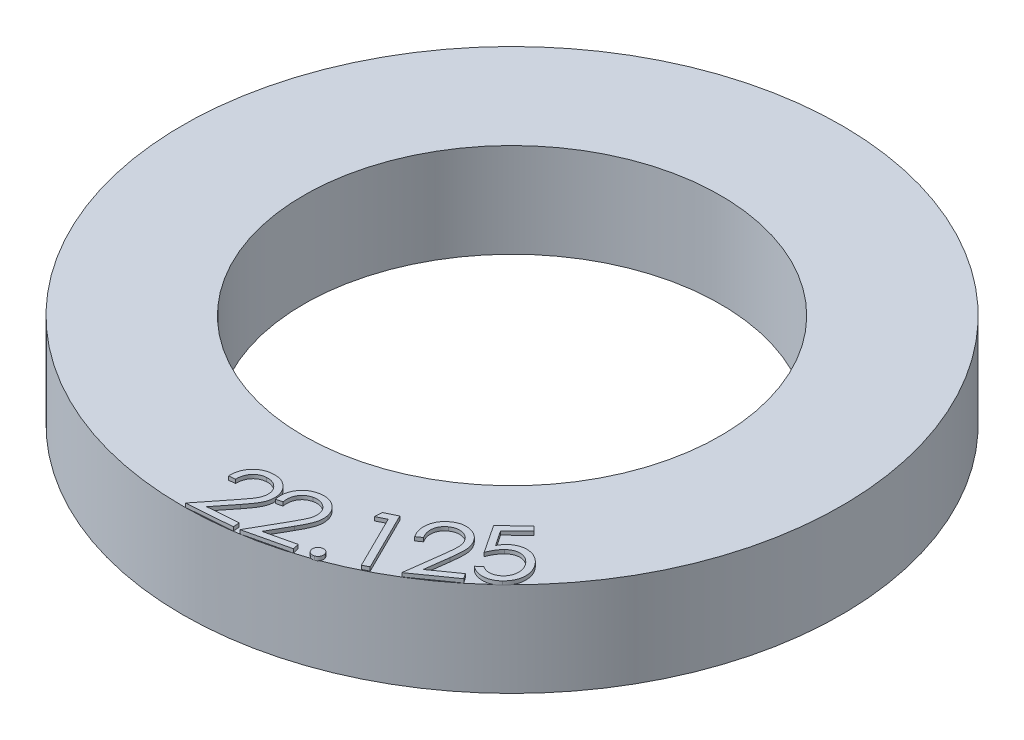
from build123d import *

# Parameters (mm, degrees)
SKETCH1_R           = 17.5
SKETCH1_R_2         = 11.0625
BOSS_EXTRUDE1_DEPTH = 5
BOSS_EXTRUDE6_DEPTH = 0.2


with BuildPart() as part:
    # Sketch1 → Boss-Extrude1 (new body)
    with BuildSketch(Plane(origin=(0, 0, 0), x_dir=(1, 0, 0), z_dir=(0, 1, 0))):
        Circle(SKETCH1_R)
        Circle(SKETCH1_R_2, mode=Mode.SUBTRACT)
    extrude(amount=BOSS_EXTRUDE1_DEPTH)

    # Sketch6 → Boss-Extrude6 (add)
    with BuildSketch(Plane(origin=(0, 5, 0), x_dir=(1, 0, 0), z_dir=(0, 1, 0))):
        with BuildLine():
            Line((0.377203526, -15.06640625), (0.043469551, -15.092347756))
            add(Edge.make_bspline(
                [(0.043469551, -15.092347756), (0.042203297, -15.050032699), (0.039723419, -14.96716131), (0.049638285, -14.844981972), (0.067688405, -14.727624407), (0.098455755, -14.61556583), (0.138504263, -14.508522308), (0.188279293, -14.405930448), (0.249943807, -14.309195828), (0.320224245, -14.217586795), (0.399116148, -14.133937543), (0.484222111, -14.059456033), (0.574336923, -13.993992114), (0.671078969, -13.940092371), (0.773224869, -13.895612995), (0.881084602, -13.861423192), (0.994390789, -13.836174987), (1.072362547, -13.828578994), (1.111979167, -13.824719551)],
                knots=[0, 0, 0, 0, 1.099165856, 2.152647473, 3.179901334, 4.180092559, 5.165857059, 6.14623908, 7.136854445, 8.141313093, 9.142222958, 10.119044223, 11.076246807, 12.030555843, 12.990566437, 13.966122304, 14.966608418, 16, 16, 16, 16], degree=3))
            add(Edge.make_bspline(
                [(1.111979167, -13.824719551), (1.151232363, -13.822614291), (1.227892409, -13.818502795), (1.341072803, -13.824300473), (1.449209712, -13.840047194), (1.552456645, -13.867170925), (1.650809554, -13.903432336), (1.744251767, -13.950064736), (1.832189716, -14.007297288), (1.914237577, -14.07371881), (1.989801801, -14.146775331), (2.056191283, -14.225750107), (2.115236363, -14.307662186), (2.163673815, -14.394967734), (2.203994369, -14.485852699), (2.23381166, -14.581483532), (2.256306856, -14.680631266), (2.263224051, -14.74868976), (2.266726763, -14.783153045)],
                knots=[0, 0, 0, 0, 1.125255338, 2.197582177, 3.23984224, 4.249678898, 5.249348258, 6.237204937, 7.234226399, 8.248247252, 9.256507582, 10.239567543, 11.199778339, 12.143800945, 13.093950023, 14.042329097, 15.008679649, 16, 16, 16, 16], degree=3))
            add(Edge.make_bspline(
                [(2.266726763, -14.783153045), (2.268653871, -14.83201524), (2.272472697, -14.928842275), (2.256591946, -15.073272294), (2.221554197, -15.213909987), (2.177756368, -15.329043673), (2.13210079, -15.422970742), (2.088829613, -15.499650514), (2.039151976, -15.583479859), (1.980752569, -15.67318269), (1.913642882, -15.76882397), (1.840613729, -15.872212721), (1.757921696, -15.980725817), (1.700055339, -16.055042687), (1.670072115, -16.093549679)],
                knots=[0, 0, 0, 0, 1.190284496, 2.358709392, 3.525773572, 4.713480732, 5.352743619, 6.06901355, 6.858115264, 7.726847504, 8.676217017, 9.704931629, 10.810819393, 12, 12, 12, 12], degree=3))
            Line((1.670072115, -16.093549679), (0.875701122, -17.094751603))
            Line((0.875701122, -17.094751603), (2.482672276, -16.971354167))
            Line((2.482672276, -16.971354167), (2.508613782, -17.307191506))
            Line((2.508613782, -17.307191506), (0.14443109, -17.488782051))
            Line((0.14443109, -17.488782051), (1.363681891, -15.949819712))
            add(Edge.make_bspline(
                [(1.363681891, -15.949819712), (1.393527022, -15.912554926), (1.450782044, -15.841066007), (1.530584566, -15.73612355), (1.602999147, -15.639675593), (1.666852925, -15.550639363), (1.722438282, -15.469396851), (1.76961629, -15.395481899), (1.809021619, -15.329602995), (1.849329165, -15.251857602), (1.888211722, -15.159145837), (1.917541309, -15.046099013), (1.933704742, -14.93175562), (1.93042781, -14.855174346), (1.928786058, -14.816806891)],
                knots=[0, 0, 0, 0, 1.323859622, 2.539697786, 3.655679983, 4.668207506, 5.577749991, 6.384956845, 7.099630202, 7.705429782, 8.812646299, 9.878423536, 10.93708365, 12, 12, 12, 12], degree=3))
            add(Edge.make_bspline(
                [(1.928786058, -14.816806891), (1.92620974, -14.792668697), (1.921140936, -14.745177743), (1.905685163, -14.675960851), (1.882668381, -14.610204079), (1.854314913, -14.54686504), (1.818130268, -14.487171166), (1.775716227, -14.430480301), (1.726271651, -14.377301953), (1.671340099, -14.327125852), (1.611934069, -14.281949704), (1.548780398, -14.24375581), (1.483443961, -14.212316408), (1.415907726, -14.186368957), (1.345139571, -14.169292508), (1.271999298, -14.157876025), (1.196114655, -14.153502913), (1.144924611, -14.156323447), (1.118990385, -14.157752404)],
                knots=[0, 0, 0, 0, 1.002985613, 1.973335034, 2.923515741, 3.878986154, 4.836651989, 5.802759845, 6.800988188, 7.833639541, 8.87511098, 9.880838076, 10.878972912, 11.86950441, 12.865345595, 13.881918786, 14.926924211, 16, 16, 16, 16], degree=3))
            add(Edge.make_bspline(
                [(1.118990385, -14.157752404), (1.091811261, -14.160540619), (1.038491161, -14.166010548), (0.960749235, -14.182373159), (0.886899306, -14.205342141), (0.817246391, -14.235736869), (0.751710741, -14.272344942), (0.690146343, -14.315288584), (0.633132276, -14.365692478), (0.580060436, -14.422065975), (0.532383632, -14.484564259), (0.490634628, -14.552362028), (0.455698611, -14.625546395), (0.426899376, -14.703718722), (0.404472482, -14.787020099), (0.388336351, -14.875402791), (0.379467781, -14.969236984), (0.377971809, -15.033435801), (0.377203526, -15.06640625)],
                knots=[0, 0, 0, 0, 1.003856858, 1.969369873, 2.914991585, 3.842326504, 4.757764574, 5.67065914, 6.596081697, 7.550367434, 8.512664105, 9.480773, 10.472199548, 11.488843046, 12.539268398, 13.639696742, 14.787824085, 16, 16, 16, 16], degree=3))
        make_face()
        with BuildLine():
            Line((2.680077799, -14.84254585), (2.355458408, -14.918267004))
            add(Edge.make_bspline(
                [(2.355458408, -14.918267004), (2.347994142, -14.876767046), (2.333387531, -14.795556953), (2.323472579, -14.673990721), (2.324976016, -14.555728299), (2.336513827, -14.440605451), (2.359783356, -14.328975701), (2.394590343, -14.221092867), (2.439601661, -14.116379831), (2.494569659, -14.015576781), (2.559832485, -13.921863348), (2.631188548, -13.834656401), (2.710921768, -13.757361702), (2.797573287, -13.688946733), (2.891342116, -13.629703088), (2.992353062, -13.580084855), (3.099856127, -13.537971321), (3.175300136, -13.518303724), (3.213631485, -13.508311075)],
                knots=[0, 0, 0, 0, 1.100238416, 2.153025381, 3.178012026, 4.183884262, 5.168591255, 6.148695239, 7.138002634, 8.140019377, 9.140121407, 10.114951831, 11.077023251, 12.032670763, 12.99234068, 13.966349905, 14.966749606, 16, 16, 16, 16], degree=3))
            add(Edge.make_bspline(
                [(3.213631485, -13.508311075), (3.251843088, -13.50036415), (3.32664053, -13.484808413), (3.438897548, -13.473770246), (3.547813259, -13.472847982), (3.653615731, -13.482442125), (3.755983303, -13.503477882), (3.854414489, -13.536291351), (3.950096274, -13.578421826), (4.040814221, -13.631584861), (4.126003653, -13.692404589), (4.204208412, -13.758970295), (4.274030899, -13.831494589), (4.335160407, -13.90960072), (4.388361962, -13.993145467), (4.432982751, -14.082231672), (4.470178835, -14.176708828), (4.487307474, -14.242643219), (4.495983248, -14.27603944)],
                knots=[0, 0, 0, 0, 1.121990491, 2.196244399, 3.238232453, 4.250969426, 5.246356061, 6.236987075, 7.230101134, 8.248200839, 9.255501669, 10.237657177, 11.19803806, 12.146105858, 13.086011545, 14.042029985, 15.008274769, 16, 16, 16, 16], degree=3))
            add(Edge.make_bspline(
                [(4.495983248, -14.27603944), (4.505415824, -14.323774993), (4.524110077, -14.41838123), (4.529985585, -14.56283772), (4.516844757, -14.706380405), (4.49162199, -14.826395359), (4.460506924, -14.925374116), (4.431085731, -15.007919873), (4.393488718, -15.097141834), (4.349829317, -15.194418504), (4.299347185, -15.299042154), (4.242538162, -15.411720311), (4.177915647, -15.531101044), (4.131979942, -15.612908193), (4.108262895, -15.655146011)],
                knots=[0, 0, 0, 0, 1.190223456, 2.358882579, 3.52524119, 4.712819824, 5.35365978, 6.065105631, 6.857984567, 7.723828008, 8.67607557, 9.702436758, 10.813745988, 12, 12, 12, 12], degree=3))
            Line((4.108262895, -15.655146011), (3.479356645, -16.761516203))
            Line((3.479356645, -16.761516203), (5.041456004, -16.394829504))
            Line((5.041456004, -16.394829504), (5.11787828, -16.721552261))
            Line((5.11787828, -16.721552261), (2.819601036, -17.260714921))
            Line((2.819601036, -17.260714921), (3.785045748, -15.56119569))
            add(Edge.make_bspline(
                [(3.785045748, -15.56119569), (3.808529371, -15.519892567), (3.8536226, -15.440582352), (3.91665988, -15.325551236), (3.973290102, -15.219474376), (4.021957514, -15.121779814), (4.064311127, -15.032979861), (4.100364837, -14.953571722), (4.128654637, -14.882434307), (4.156784414, -14.800101176), (4.179688984, -14.702577351), (4.192972915, -14.587024863), (4.189968714, -14.471889792), (4.175230987, -14.396958355), (4.167858248, -14.359472934)],
                knots=[0, 0, 0, 0, 1.322508168, 2.539478858, 3.65113322, 4.669382137, 5.577246142, 6.389686428, 7.096378664, 7.707362647, 8.810322298, 9.877140803, 10.938012216, 12, 12, 12, 12], degree=3))
            add(Edge.make_bspline(
                [(4.167858248, -14.359472934), (4.161829404, -14.336171476), (4.149935411, -14.290201239), (4.123387221, -14.224893717), (4.091995869, -14.16328915), (4.053584185, -14.106135055), (4.009399893, -14.052600205), (3.95860095, -14.003544562), (3.901957352, -13.958350343), (3.840235373, -13.917568468), (3.775029978, -13.881814057), (3.707248163, -13.853637752), (3.637912338, -13.832678602), (3.56741324, -13.817301491), (3.494890393, -13.811664684), (3.421495235, -13.811468351), (3.346244991, -13.818247864), (3.296509601, -13.82889709), (3.271123472, -13.834332709)],
                knots=[0, 0, 0, 0, 0.998805992, 1.97049261, 2.921394182, 3.866479787, 4.824835265, 5.799717433, 6.794315519, 7.830951375, 8.869177059, 9.878822869, 10.873799922, 11.875291578, 12.869368348, 13.888722291, 14.922353531, 16, 16, 16, 16], degree=3))
            add(Edge.make_bspline(
                [(3.271123472, -13.834332709), (3.244792519, -13.841064204), (3.193002937, -13.854304184), (3.119061623, -13.882705923), (3.050115946, -13.91714881), (2.986034959, -13.957311139), (2.926579811, -14.002814596), (2.87305675, -14.05555418), (2.823928987, -14.113545846), (2.780414933, -14.177443519), (2.743380272, -14.246402199), (2.712244756, -14.319205359), (2.689061885, -14.396615139), (2.673136557, -14.477873433), (2.664009273, -14.563501926), (2.662180891, -14.653056839), (2.666949138, -14.746824786), (2.675629023, -14.810109822), (2.680077799, -14.84254585)],
                knots=[0, 0, 0, 0, 1.001857296, 1.97052376, 2.915105733, 3.840812044, 4.756468097, 5.670946457, 6.606992161, 7.556283339, 8.516782409, 9.490308786, 10.47212129, 11.491627338, 12.540773751, 13.644567144, 14.792749573, 16, 16, 16, 16], degree=3))
        make_face()
        with BuildLine():
            add(Edge.make_bspline(
                [(5.812610444, -15.938128556), (5.831374417, -15.932374898), (5.868100028, -15.921113607), (5.925587729, -15.918820778), (5.982023209, -15.927326543), (6.036365652, -15.947186897), (6.086750753, -15.976062519), (6.129683552, -16.014781695), (6.164195697, -16.061839206), (6.179302393, -16.097844445), (6.187009483, -16.116213491)],
                knots=[0, 0, 0, 0, 1.018533362, 1.993514881, 2.966138152, 3.9748784, 4.989476654, 5.972026843, 6.965374611, 8, 8, 8, 8], degree=3))
            add(Edge.make_bspline(
                [(6.187009483, -16.116213491), (6.192680674, -16.134982532), (6.203852009, -16.171954526), (6.207259114, -16.229869607), (6.198423544, -16.286997519), (6.178873974, -16.341926891), (6.149719297, -16.392227049), (6.111823907, -16.435344643), (6.065578658, -16.469979456), (6.029886494, -16.484584723), (6.011729034, -16.492014773)],
                knots=[0, 0, 0, 0, 1.018247088, 2.005783202, 2.990165439, 4.010083513, 5.024396598, 5.998572224, 6.981825626, 8, 8, 8, 8], degree=3))
            add(Edge.make_bspline(
                [(6.011729034, -16.492014773), (5.992964701, -16.497770106), (5.956238387, -16.509034678), (5.898755786, -16.511303732), (5.842003107, -16.502843983), (5.787364663, -16.482393394), (5.737095106, -16.452595757), (5.694096527, -16.414271405), (5.660232144, -16.367416245), (5.645083379, -16.332037335), (5.637329996, -16.313929838)],
                knots=[0, 0, 0, 0, 1.019327242, 1.995068695, 2.968450063, 3.99358383, 5.015165017, 5.99848104, 6.975590248, 8, 8, 8, 8], degree=3))
            add(Edge.make_bspline(
                [(5.637329996, -16.313929838), (5.63125142, -16.294941947), (5.619366426, -16.257816312), (5.617673921, -16.1996281), (5.624612676, -16.142442807), (5.645777227, -16.087974496), (5.675371175, -16.038150206), (5.712952105, -15.994657098), (5.759716127, -15.961248414), (5.794765915, -15.945928316), (5.812610444, -15.938128556)],
                knots=[0, 0, 0, 0, 1.033330105, 2.02039479, 3.003248301, 4.016090021, 5.036799157, 6.01117572, 6.98745084, 8, 8, 8, 8], degree=3))
        make_face()
        Polygon((5.818273577, -12.696277718), (6.43245627, -12.391289737), (7.984038802, -15.51759182), (7.673441847, -15.671838615), (6.274002744, -12.851926756), (5.783217488, -13.095216019), align=None)
        with BuildLine():
            Line((8.050451954, -12.754316345), (7.778416698, -12.946423717))
            add(Edge.make_bspline(
                [(7.778416698, -12.946423717), (7.75574982, -12.911071608), (7.711236137, -12.841646407), (7.657400837, -12.73213566), (7.614471669, -12.622110368), (7.582436796, -12.511152703), (7.561988666, -12.399113636), (7.552932152, -12.285912712), (7.554820027, -12.171722581), (7.569204713, -12.057910275), (7.593409527, -11.946382394), (7.62776704, -11.839210811), (7.672436867, -11.737666062), (7.725890768, -11.641112131), (7.79168322, -11.551877682), (7.865376088, -11.467017122), (7.949826615, -11.388142819), (8.012361399, -11.341448202), (8.044141858, -11.317717787)],
                knots=[0, 0, 0, 0, 1.095910755, 2.15217216, 3.180126126, 4.176880321, 5.163267028, 6.149049379, 7.137906323, 8.140157143, 9.13972864, 10.114396539, 11.073656743, 12.032781037, 12.989864371, 13.963002478, 14.964788651, 16, 16, 16, 16], degree=3))
            add(Edge.make_bspline(
                [(8.044141858, -11.317717787), (8.076472772, -11.295823523), (8.139898005, -11.252872407), (8.239602263, -11.200435781), (8.340159306, -11.159320127), (8.441509898, -11.128739377), (8.544029438, -11.109825824), (8.647456298, -11.101966441), (8.751596202, -11.105561252), (8.855601523, -11.120422057), (8.956988223, -11.145096031), (9.054630438, -11.176757121), (9.145718513, -11.219123476), (9.232893852, -11.266708516), (9.312822977, -11.325339494), (9.388367885, -11.390285486), (9.457612974, -11.464633547), (9.498524369, -11.519247649), (9.519302115, -11.546984614)],
                knots=[0, 0, 0, 0, 1.123413124, 2.203857893, 3.235853446, 4.246956373, 5.245898599, 6.230969123, 7.227279684, 8.239657717, 9.24977525, 10.228460745, 11.188962283, 12.137823534, 13.082621121, 14.036430835, 15.002758488, 16, 16, 16, 16], degree=3))
            add(Edge.make_bspline(
                [(9.519302115, -11.546984614), (9.546136241, -11.587705558), (9.599185969, -11.668208831), (9.658881509, -11.800157687), (9.702061595, -11.937869617), (9.722679402, -12.058885035), (9.732181386, -12.162185813), (9.734148543, -12.249728189), (9.734685561, -12.346541682), (9.729584649, -12.452882377), (9.723214718, -12.568900579), (9.71118776, -12.694325344), (9.697732364, -12.829303694), (9.685497933, -12.922148442), (9.679157884, -12.970261858)],
                knots=[0, 0, 0, 0, 1.192690377, 2.357889283, 3.532704618, 4.718274557, 5.356120917, 6.071885258, 6.861684818, 7.72656775, 8.678338785, 9.706873352, 10.81167048, 12, 12, 12, 12], degree=3))
            Line((9.679157884, -12.970261858), (9.512290897, -14.230878845))
            Line((9.512290897, -14.230878845), (10.821285288, -13.304696954))
            Line((10.821285288, -13.304696954), (11.015496025, -13.578835576))
            Line((11.015496025, -13.578835576), (9.089514454, -14.941816345))
            Line((9.089514454, -14.941816345), (9.344722788, -13.005317947))
            add(Edge.make_bspline(
                [(9.344722788, -13.005317947), (9.350876253, -12.958119344), (9.362688595, -12.86751576), (9.378466315, -12.736925142), (9.390139674, -12.617201917), (9.399637953, -12.508325237), (9.40541387, -12.410129646), (9.407505869, -12.322670012), (9.407018709, -12.24619548), (9.40284618, -12.159549845), (9.387983767, -12.060735698), (9.35662303, -11.949019827), (9.309914016, -11.84385806), (9.268689788, -11.779736732), (9.24796798, -11.747505447)],
                knots=[0, 0, 0, 0, 1.324853112, 2.543220171, 3.661061288, 4.672878806, 5.585066668, 6.398427791, 7.107504353, 7.713344522, 8.811787278, 9.880452689, 10.934586436, 12, 12, 12, 12], degree=3))
            add(Edge.make_bspline(
                [(9.24796798, -11.747505447), (9.233657583, -11.728231526), (9.205439981, -11.690226719), (9.156305176, -11.639664518), (9.103798852, -11.594377304), (9.046418065, -11.555725547), (8.985430881, -11.522711926), (8.920190146, -11.495616733), (8.850675878, -11.475851572), (8.778309459, -11.460808051), (8.704311792, -11.453588897), (8.630865103, -11.451618421), (8.558426348, -11.458031186), (8.487892712, -11.472366479), (8.41818143, -11.492610084), (8.350278879, -11.521041939), (8.283220962, -11.555981846), (8.240903361, -11.584427953), (8.219422307, -11.598867627)],
                knots=[0, 0, 0, 0, 0.995891806, 1.963724675, 2.920595791, 3.870799422, 4.83047179, 5.796502588, 6.797676676, 7.827373342, 8.86163348, 9.880849032, 10.874610586, 11.873854222, 12.865718377, 13.884009387, 14.92589116, 16, 16, 16, 16], degree=3))
            add(Edge.make_bspline(
                [(8.219422307, -11.598867627), (8.197589765, -11.615054748), (8.154752739, -11.646815049), (8.096961715, -11.700815823), (8.045494088, -11.757941208), (8.001952156, -11.819711245), (7.964339584, -11.884261253), (7.934384174, -11.952862894), (7.909880694, -12.024678442), (7.89445669, -12.10031943), (7.884819795, -12.177945688), (7.884534713, -12.257144815), (7.89140539, -12.337478617), (7.907111722, -12.419166672), (7.931153756, -12.501882181), (7.963168631, -12.585625545), (8.002095467, -12.670812788), (8.034085463, -12.726054154), (8.050451954, -12.754316345)],
                knots=[0, 0, 0, 0, 1.002821556, 1.9676084, 2.914987817, 3.836871811, 4.753084116, 5.668686655, 6.59648861, 7.549354221, 8.513755073, 9.480276974, 10.467796518, 11.486640661, 12.546326272, 13.644184179, 14.79473446, 16, 16, 16, 16], degree=3))
        make_face()
        with BuildLine():
            Line((10.452754524, -9.291042604), (10.68552696, -9.530826258))
            Line((10.68552696, -9.530826258), (9.789493306, -10.399516162))
            Line((9.789493306, -10.399516162), (10.327954844, -11.205105104))
            add(Edge.make_bspline(
                [(10.327954844, -11.205105104), (10.347405355, -11.172122652), (10.385204959, -11.108025431), (10.446885728, -11.0193262), (10.509702256, -10.939697419), (10.555405561, -10.893202352), (10.577554203, -10.870670008)],
                knots=[0, 0, 0, 0, 1.0972362, 2.132339663, 3.094898282, 4, 4, 4, 4], degree=3))
            add(Edge.make_bspline(
                [(10.577554203, -10.870670008), (10.606317416, -10.844200281), (10.662747921, -10.792269364), (10.753702799, -10.724629144), (10.848024177, -10.668009567), (10.945991502, -10.62309149), (11.04674006, -10.588531661), (11.150525188, -10.564262159), (11.257758966, -10.552017687), (11.36719103, -10.549746582), (11.476645925, -10.558902183), (11.583969895, -10.578635191), (11.688412673, -10.608797506), (11.789577002, -10.650442128), (11.88756755, -10.702847316), (11.982623387, -10.765422339), (12.074164549, -10.839462139), (12.130996143, -10.895414044), (12.159986094, -10.923955265)],
                knots=[0, 0, 0, 0, 1.056660519, 2.073060671, 3.059518756, 4.02677442, 4.98224816, 5.935943106, 6.903425925, 7.895980916, 8.891750929, 9.868685659, 10.842855965, 11.826495158, 12.821843791, 13.84390824, 14.900171671, 16, 16, 16, 16], degree=3))
            add(Edge.make_bspline(
                [(12.159986094, -10.923955265), (12.179371474, -10.944790443), (12.217879566, -10.986178488), (12.27122311, -11.051190736), (12.319127373, -11.119122899), (12.362370005, -11.188926824), (12.401443021, -11.260839418), (12.434751195, -11.335040663), (12.463945876, -11.411244998), (12.48736708, -11.489374708), (12.506429447, -11.568206729), (12.519773102, -11.646915148), (12.527677962, -11.725163122), (12.529442244, -11.802697072), (12.527212836, -11.879846664), (12.517429582, -11.956344907), (12.503941494, -12.032619884), (12.48378444, -12.107875306), (12.459677752, -12.18213013), (12.429283702, -12.254748742), (12.393111387, -12.325269634), (12.353457012, -12.395471186), (12.306878168, -12.462802716), (12.256204782, -12.529296219), (12.200270131, -12.593980231), (12.159104301, -12.634499511), (12.138251319, -12.655024976)],
                knots=[0, 0, 0, 0, 1.055652629, 2.097001478, 3.117016048, 4.137178009, 5.141932989, 6.150831921, 7.15243954, 8.167281964, 9.17461492, 10.159572065, 11.126698888, 12.089462946, 13.035170943, 13.986940597, 14.947789716, 15.906759268, 16.874624253, 17.842372723, 18.823391324, 19.813866479, 20.831113527, 21.857739712, 22.91481563, 24, 24, 24, 24], degree=3))
            add(Edge.make_bspline(
                [(12.138251319, -12.655024976), (12.112728931, -12.678884978), (12.062572626, -12.725774383), (11.981204616, -12.786743559), (11.897891282, -12.839563216), (11.81168422, -12.883702587), (11.722425767, -12.917787042), (11.630937819, -12.943862727), (11.536875372, -12.961812787), (11.440809295, -12.969665841), (11.344361381, -12.970104026), (11.249100137, -12.960666604), (11.15568141, -12.943230755), (11.064168704, -12.917126414), (10.974739633, -12.88265442), (10.887481161, -12.839323474), (10.801350171, -12.788490568), (10.74732779, -12.747875068), (10.719881928, -12.727240521)],
                knots=[0, 0, 0, 0, 1.074988754, 2.112555675, 3.124661908, 4.109336649, 5.08879237, 6.06132568, 7.03505602, 8.031750268, 9.024697533, 10.000552301, 10.974282641, 11.946815951, 12.926271671, 13.920599676, 14.943568705, 16, 16, 16, 16], degree=3))
            Line((10.719881928, -12.727240521), (10.977894748, -12.477641162))
            add(Edge.make_bspline(
                [(10.977894748, -12.477641162), (11.005569592, -12.495806132), (11.058958533, -12.530849094), (11.142274933, -12.571307457), (11.223303732, -12.601834409), (11.303835464, -12.619418621), (11.384206354, -12.626812892), (11.465592515, -12.622543133), (11.548546659, -12.610395006), (11.631541431, -12.586678649), (11.713315566, -12.555227199), (11.79003461, -12.513203013), (11.863081375, -12.465249111), (11.905744814, -12.425918472), (11.927213658, -12.406126739)],
                knots=[0, 0, 0, 0, 1.146609473, 2.21198236, 3.203991316, 4.141735567, 5.06091789, 5.993607636, 6.960785206, 7.9613937, 8.980047274, 9.991456537, 10.989272553, 12, 12, 12, 12], degree=3))
            add(Edge.make_bspline(
                [(11.927213658, -12.406126739), (11.947116828, -12.386005376), (11.986402209, -12.346289317), (12.035962279, -12.279596876), (12.078460887, -12.209980418), (12.112896717, -12.13660745), (12.140008149, -12.059672512), (12.157877371, -11.97865727), (12.168483663, -11.893913963), (12.170909111, -11.806404543), (12.166734501, -11.718027891), (12.151985482, -11.63131791), (12.130873661, -11.546673074), (12.099180165, -11.465112367), (12.060839275, -11.385488303), (12.013270909, -11.308543182), (11.957268088, -11.234236594), (11.914534234, -11.187928511), (11.892858691, -11.16444004)],
                knots=[0, 0, 0, 0, 0.981100706, 1.936521514, 2.875413226, 3.807837019, 4.744062615, 5.700309258, 6.681141738, 7.70357785, 8.73517306, 9.745864638, 10.751074282, 11.75729772, 12.776576466, 13.814275091, 14.891352574, 16, 16, 16, 16], degree=3))
            add(Edge.make_bspline(
                [(11.892858691, -11.16444004), (11.872137928, -11.144234653), (11.831654893, -11.104758529), (11.766668116, -11.052287247), (11.699295697, -11.008320363), (11.630215196, -10.970995498), (11.558251382, -10.94312445), (11.484493288, -10.922701854), (11.40860198, -10.909885054), (11.331322757, -10.905282683), (11.253452672, -10.907508432), (11.176677684, -10.919966679), (11.101316048, -10.939681012), (11.027016104, -10.966980311), (10.954630799, -11.003921394), (10.883856199, -11.049188603), (10.813827289, -11.101765043), (10.770241753, -11.142289868), (10.7479268, -11.163037797)],
                knots=[0, 0, 0, 0, 1.076879693, 2.103945646, 3.102811146, 4.067885311, 5.020966591, 5.968553643, 6.912420025, 7.879921856, 8.846132302, 9.805780904, 10.767910189, 11.742270505, 12.745972787, 13.786107055, 14.866529529, 16, 16, 16, 16], degree=3))
            add(Edge.make_bspline(
                [(10.7479268, -11.163037797), (10.72944525, -11.18196967), (10.691371943, -11.220970676), (10.637581559, -11.285710865), (10.585073113, -11.357609334), (10.533131962, -11.436086725), (10.482779483, -11.521834294), (10.43353593, -11.614646619), (10.386263425, -11.714834238), (10.356045618, -11.784382409), (10.340575037, -11.819988919)],
                knots=[0, 0, 0, 0, 0.816012069, 1.681042897, 2.593913321, 3.56181962, 4.583248113, 5.660561185, 6.802279776, 8, 8, 8, 8], degree=3))
            Line((10.340575037, -11.819988919), (9.363912376, -10.346230906))
            Line((9.363912376, -10.346230906), (10.452754524, -9.291042604))
        make_face()
    extrude(amount=BOSS_EXTRUDE6_DEPTH)


solid = part.part
